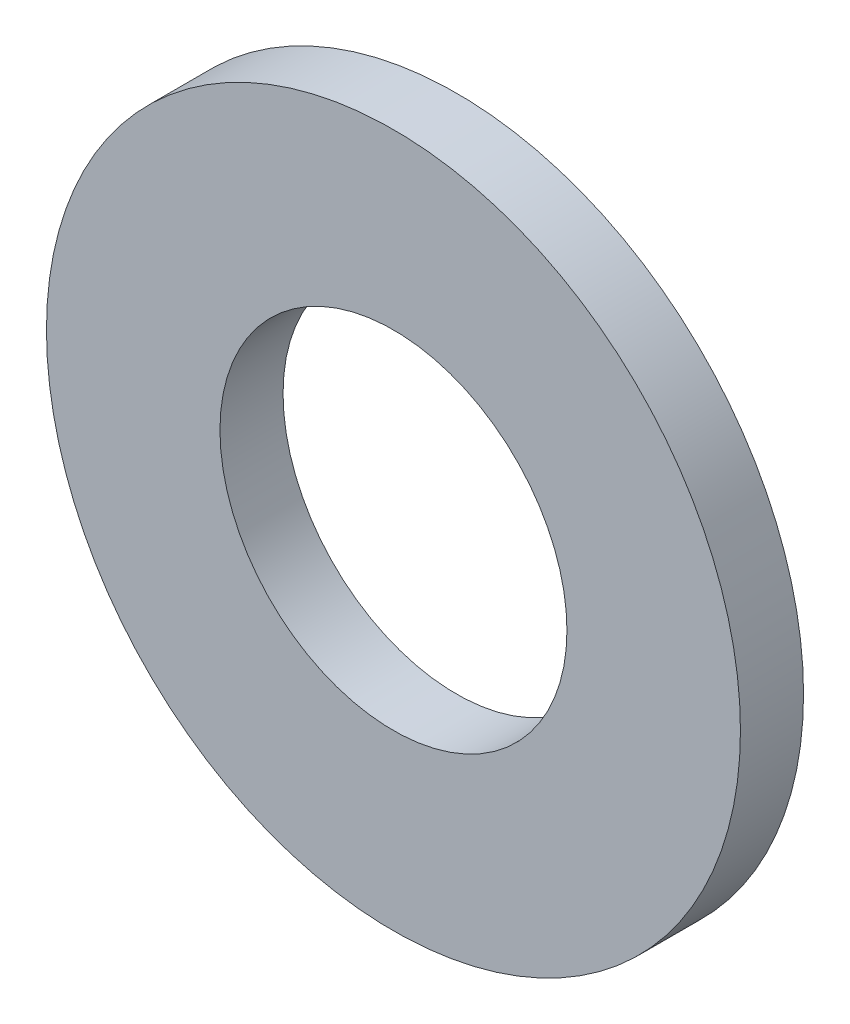
from build123d import *

# Parameters (mm, degrees)
SKETCH1_R           = 8.73125
SKETCH1_R_2         = 4.365625
BOSS_EXTRUDE1_DEPTH = 1.5875


with BuildPart() as part:
    # Sketch1 → Boss-Extrude1 (new body)
    with BuildSketch(Plane(origin=(0, 0, 0), x_dir=(0, 1, 0), z_dir=(0, 0, 1))):
        with Locations(Location((0, 0, 0), (0, 0, 270))):
            Circle(SKETCH1_R)
        with Locations(Location((0, 0, 0), (0, 0, 270))):
            Circle(SKETCH1_R_2, mode=Mode.SUBTRACT)
    extrude(amount=BOSS_EXTRUDE1_DEPTH)


solid = part.part
